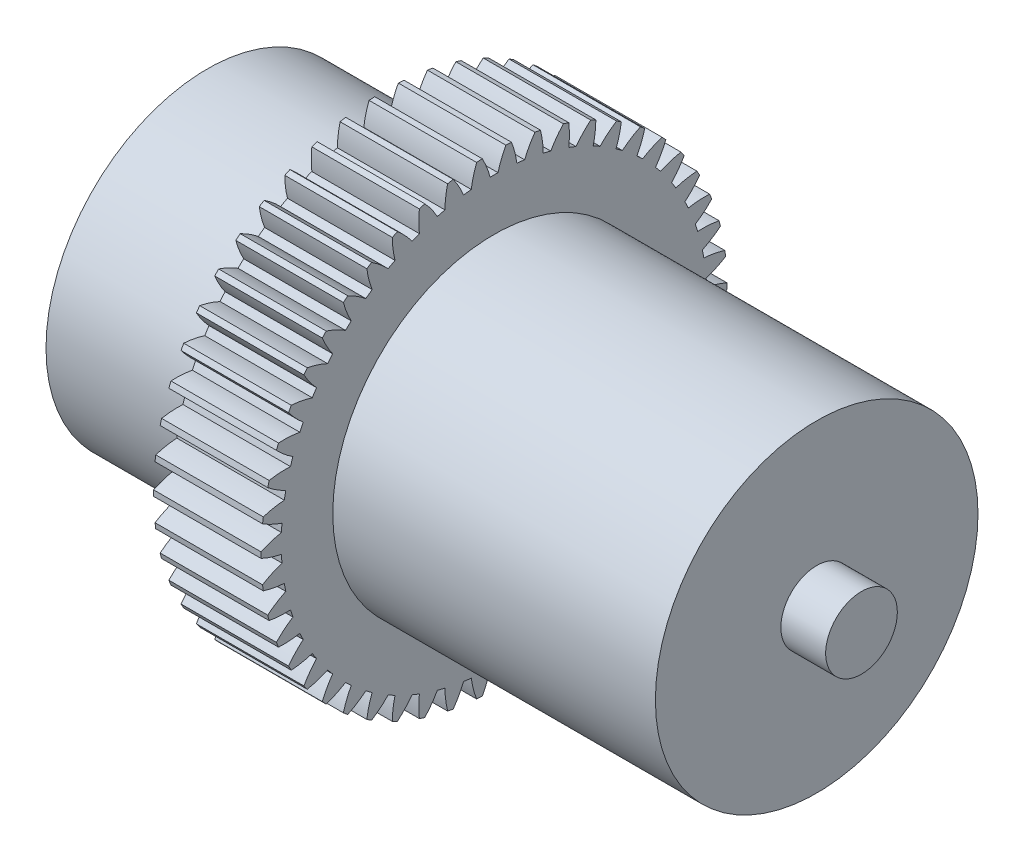
from build123d import *

# Parameters (mm, degrees)
BASPROSKE_W         = 12
BASPROSKE_H         = 26
TOOTHCUT_DEPTH      = 39.678159212
TEETHCUTS_COUNT     = 50
TEETHCUTS_ANGLE     = 352.8
BORSKE_R            = 4
BORE_DEPTH          = 50.0000508
SKETCH1_R           = 18
BOSS_EXTRUDE1_DEPTH = 36
BOSS_EXTRUDE2_START = 5
SKETCH2_R           = 4
BOSS_EXTRUDE2_DEPTH = 5
BOSS_EXTRUDE3_START = 20
SKETCH3_R           = 18
BOSS_EXTRUDE3_DEPTH = 20


with BuildPart() as part:
    # BasProSke → Base-Revolve (revolve)
    with BuildSketch(Plane(origin=(0, 0, 0), x_dir=(1, 0, 0), z_dir=(0, 1, 0)), mode=Mode.PRIVATE) as base_revolve_sk:
        with Locations((6, 13)):
            Rectangle(BASPROSKE_W, BASPROSKE_H)
    revolve(base_revolve_sk.sketch.rotate(Axis((-10, 0, 0), (1, 0, 0)), 180), axis=Axis((-10, 0, 0), (1, 0, 0)))

    # TooCutSke → ToothCut (cut, through all)
    with BuildSketch(Plane(origin=(0, 0, 0), x_dir=(0, 0, -1), z_dir=(1, 0, 0))):
        with BuildLine():
            ThreePointArc((0.437663408, 23.744966872), (0, 23.749), (-0.437663408, 23.744966872))
            ThreePointArc((-0.437663408, 23.744966872), (-0.815428123, 24.895236298), (-1.329433358, 25.991422664))
            ThreePointArc((-1.329433358, 25.991422664), (0, 26.0254), (1.329433358, 25.991422664))
            ThreePointArc((1.329433358, 25.991422664), (0.815428123, 24.895236298), (0.437663408, 23.744966872))
        make_face()
    toothcut = extrude(amount=TOOTHCUT_DEPTH, mode=Mode.SUBTRACT)

    # TeethCuts: ToothCut ×50 about axis
    teethcuts_axis = Axis((-10, 0, 0), (1, 0, 0))
    for i in range(1, TEETHCUTS_COUNT):
        add(toothcut.rotate(teethcuts_axis, i * TEETHCUTS_ANGLE / (TEETHCUTS_COUNT - 1)), mode=Mode.SUBTRACT)

    # BorSke → Bore (cut, symmetric)
    with BuildSketch(Plane(origin=(0, 0, 0), x_dir=(0, 0, -1), z_dir=(1, 0, 0))):
        with Locations(Location((0, 0, 0), (0, 0, 180))):
            Circle(BORSKE_R)
    extrude(amount=BORE_DEPTH, both=True, mode=Mode.SUBTRACT)

    # Sketch1 → Boss-Extrude1 (add)
    with BuildSketch(Plane(origin=(12, 0, 0), x_dir=(0, 0, -1), z_dir=(1, 0, 0))):
        with Locations(Location((0, 0, 0), (0, 0, 180))):
            Circle(SKETCH1_R)
    extrude(amount=BOSS_EXTRUDE1_DEPTH)

    # Sketch2 → Boss-Extrude2 (add)
    with BuildSketch(Plane(origin=(48, 0, 0), x_dir=(0, 0, -1), z_dir=(1, 0, 0)).offset(BOSS_EXTRUDE2_START)):
        Circle(SKETCH2_R)
    extrude(amount=-BOSS_EXTRUDE2_DEPTH)

    # Sketch3 → Boss-Extrude3 (add)
    with BuildSketch(Plane.ZY.offset(BOSS_EXTRUDE3_START)):
        Circle(SKETCH3_R)
    extrude(amount=-BOSS_EXTRUDE3_DEPTH)


solid = part.part
